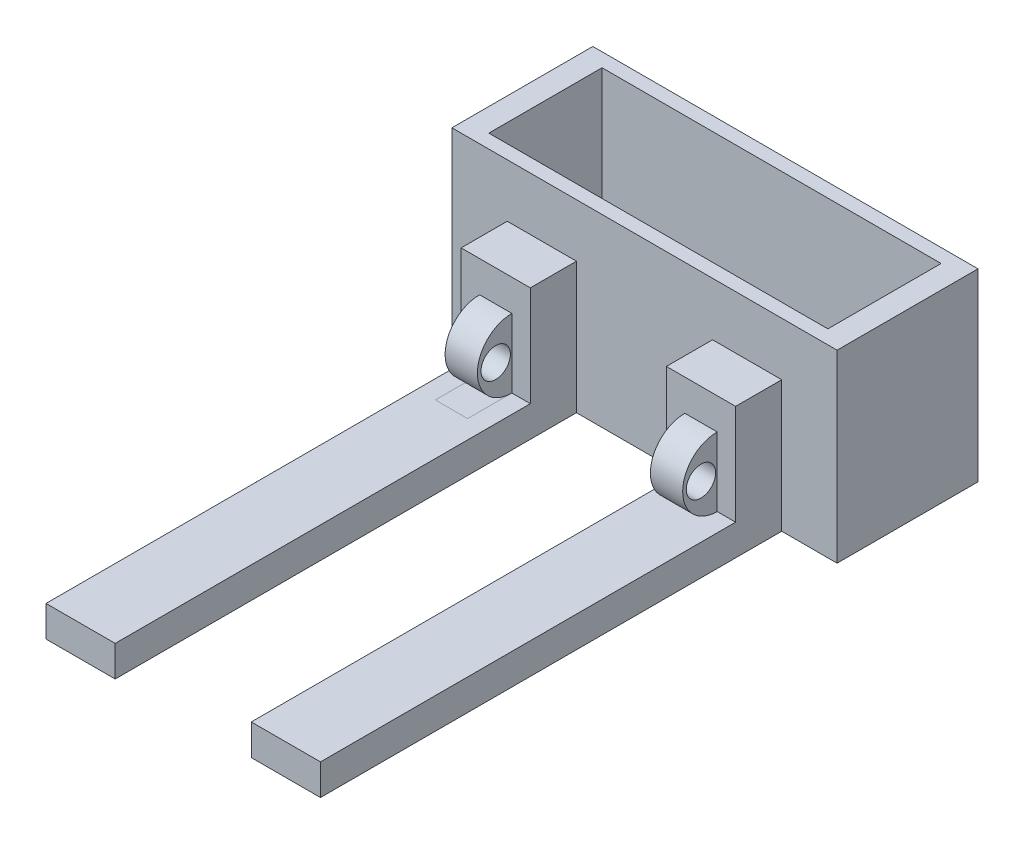
from build123d import *

# Parameters (mm, degrees)
SKETCH1_W           = 106.04999999
SKETCH1_H           = 50.8
BOSS_EXTRUDE1_DEPTH = 38.800000124
SKETCH3_W           = 93.34999999
SKETCH3_H           = 31.180000124
CUT_EXTRUDE1_DEPTH  = 64.516
BOSS_EXTRUDE2_DEPTH = 12.7
SKETCH8_W           = 19.05
SKETCH8_H           = 8.507235526
SKETCH8_H_2         = 8.509
BOSS_EXTRUDE3_DEPTH = 114.3
SKETCH9_W           = 19.05
SKETCH9_H           = 19.119005999
SKETCH9_H_2         = 19.115477052
BOSS_EXTRUDE4_DEPTH = 12.7
SKETCH10_W          = 8.89
SKETCH10_H          = 18.989146711
SKETCH10_H_2        = 18.987382237
BOSS_EXTRUDE5_DEPTH = 12.192
CUT_EXTRUDE7_DEPTH  = 78.232
SKETCH13_R          = 4.044043228
CUT_EXTRUDE9_DEPTH  = 83.82


with BuildPart() as part:
    # Sketch1 → Boss-Extrude1 (new body)
    with BuildSketch(Plane.XY):
        Rectangle(SKETCH1_W, SKETCH1_H)
    extrude(amount=BOSS_EXTRUDE1_DEPTH)

    # Sketch3 → Cut-Extrude1 (cut)
    with BuildSketch(Plane(origin=(0, 25.4, 0), x_dir=(1, 0, 0), z_dir=(0, 1, 0))):
        with Locations((0, -19.400000062)):
            Rectangle(SKETCH3_W, SKETCH3_H)
    extrude(amount=-CUT_EXTRUDE1_DEPTH, mode=Mode.SUBTRACT)

    # Sketch7 → Boss-Extrude2 (add)
    with BuildSketch(Plane.XY.offset(38.800000124)):
        Polygon((-37.784999995, -21.634664683), (-37.784999995, -25.4), (-18.734999995, -25.4), (-18.734999995, -21.634664683), (-18.734999995, -8.385528947), (-37.784999995, -8.385528947), align=None)
        Polygon((18.734999995, -21.634664683), (18.734999995, -25.4), (37.784999995, -25.4), (37.784999995, -21.634664683), (37.784999995, -8.382), (18.734999995, -8.382), align=None)
    extrude(amount=BOSS_EXTRUDE2_DEPTH)

    # Sketch8 → Boss-Extrude3 (add)
    with BuildSketch(Plane.XY.offset(51.500000124)):
        with Locations((-28.259999995, -21.146382237)):
            Rectangle(SKETCH8_W, SKETCH8_H)
        with Locations((28.259999995, -21.1455)):
            Rectangle(SKETCH8_W, SKETCH8_H_2)
    extrude(amount=BOSS_EXTRUDE3_DEPTH)

    # Sketch9 → Boss-Extrude4 (add)
    with BuildSketch(Plane.XY.offset(38.800000124)):
        with Locations((-28.259999995, 1.173974053)):
            Rectangle(SKETCH9_W, SKETCH9_H)
        with Locations((28.259999995, 1.175738526)):
            Rectangle(SKETCH9_W, SKETCH9_H_2)
    extrude(amount=BOSS_EXTRUDE4_DEPTH)

    # Sketch10 → Boss-Extrude5 (add)
    with BuildSketch(Plane.XY.offset(51.500000124)):
        with Locations((-28.259999995, -7.398191118)):
            Rectangle(SKETCH10_W, SKETCH10_H)
        with Locations((28.259999995, -7.397308882)):
            Rectangle(SKETCH10_W, SKETCH10_H_2)
    extrude(amount=BOSS_EXTRUDE5_DEPTH)

    # Sketch11 → Cut-Extrude7 (cut)
    with BuildSketch(Plane(origin=(32.704999995, 0, 0), x_dir=(0, 0, -1), z_dir=(1, 0, 0))):
        with BuildLine():
            ThreePointArc((-51.500000124, -16.891), (-60.993691242, -7.397308882), (-51.500000124, 2.096382237))
            Line((-51.500000124, 2.096382237), (-63.692000124, 2.096382237))
            Line((-63.692000124, 2.096382237), (-63.692000124, -16.891))
            Line((-63.692000124, -16.891), (-51.500000124, -16.891))
        make_face()
    extrude(amount=-CUT_EXTRUDE7_DEPTH, mode=Mode.SUBTRACT)

    # Sketch13 → Cut-Extrude9 (cut)
    with BuildSketch(Plane(origin=(32.704999995, 0, 0), x_dir=(0, 0, -1), z_dir=(1, 0, 0))):
        with Locations((-55.958857725, -7.397308882)):
            Circle(SKETCH13_R)
    extrude(amount=-CUT_EXTRUDE9_DEPTH, mode=Mode.SUBTRACT)


solid = part.part
